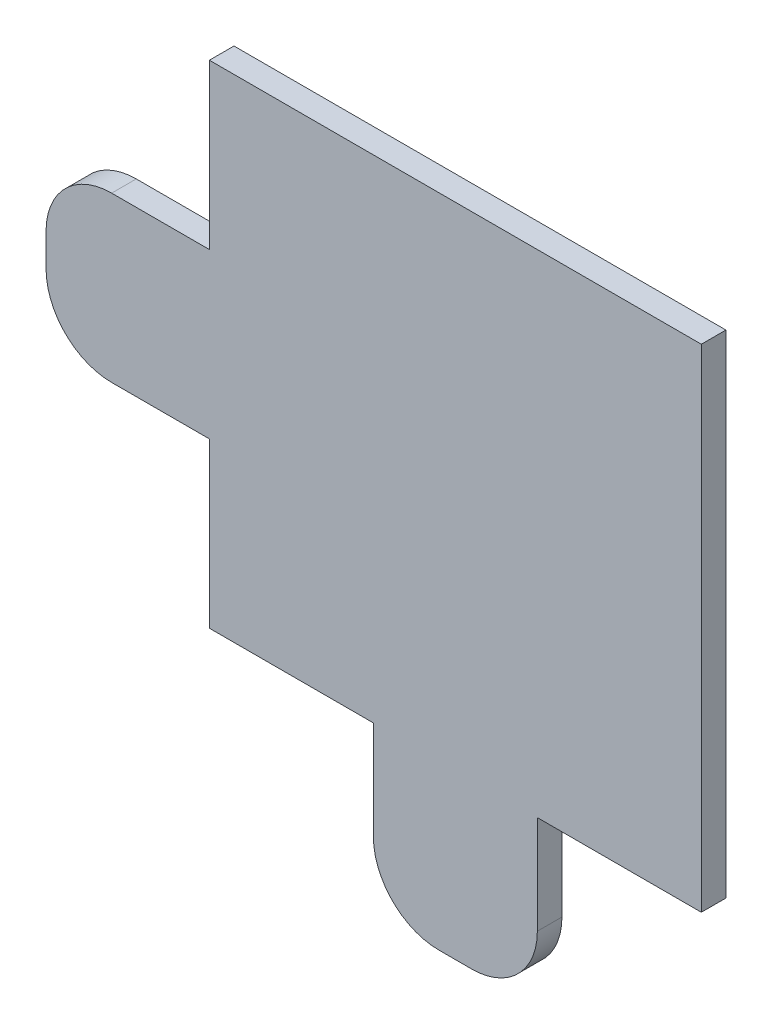
from build123d import *

# Parameters (mm, degrees)
BOSS_EXTRUDE2_DEPTH = 0.015


with BuildPart() as part:
    # Sketch1 → Boss-Extrude2 (new, symmetric)
    with BuildSketch(Plane.XY):
        with BuildLine():
            Line((-0.419197649, 0.1), (-0.3, 0.1))
            Line((-0.3, 0.1), (-0.3, 0.3))
            Line((-0.3, 0.3), (0.3, 0.3))
            Line((0.3, 0.3), (0.3, -0.3))
            Line((0.3, -0.3), (0.1, -0.3))
            Line((0.1, -0.3), (0.1, -0.42))
            ThreePointArc((0.1, -0.42), (0.076568542, -0.476568542), (0.02, -0.5))
            Line((0.02, -0.5), (-0.02, -0.5))
            ThreePointArc((-0.02, -0.5), (-0.076568542, -0.476568542), (-0.1, -0.42))
            Line((-0.1, -0.42), (-0.1, -0.3))
            Line((-0.1, -0.3), (-0.3, -0.3))
            Line((-0.3, -0.3), (-0.3, -0.1))
            Line((-0.3, -0.1), (-0.419197649, -0.1))
            ThreePointArc((-0.419197649, -0.1), (-0.475766192, -0.076568542), (-0.499197649, -0.02))
            Line((-0.499197649, -0.02), (-0.499197649, 0.02))
            ThreePointArc((-0.499197649, 0.02), (-0.475766192, 0.076568542), (-0.419197649, 0.1))
        make_face()
    extrude(amount=BOSS_EXTRUDE2_DEPTH, both=True)


solid = part.part
